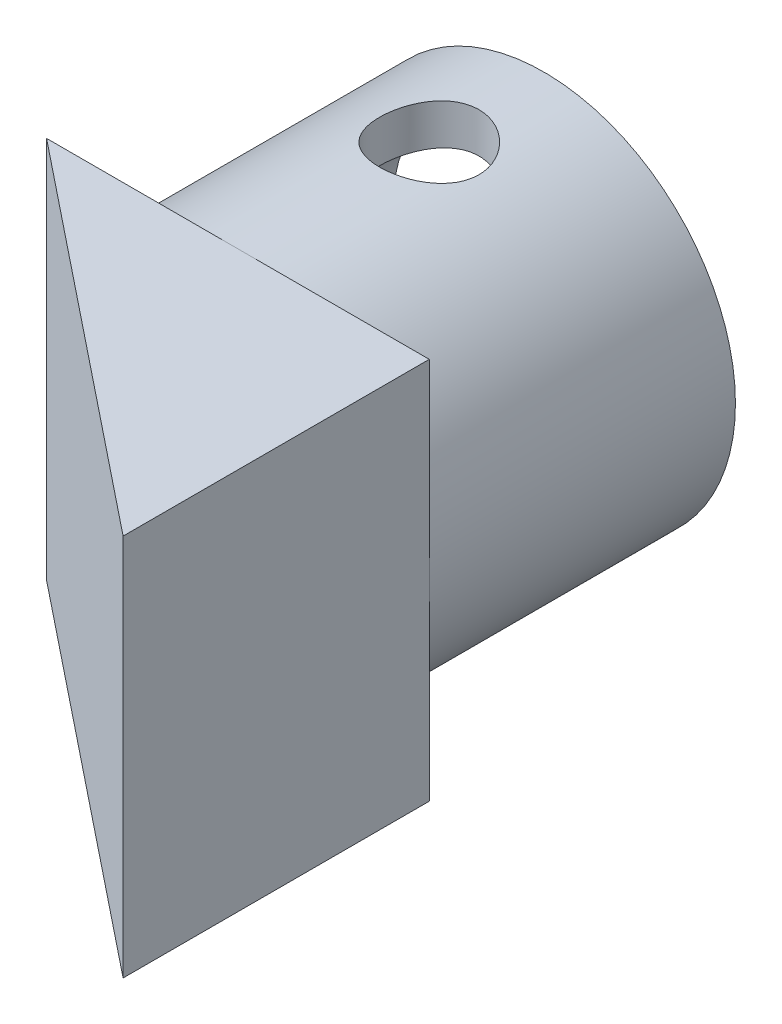
from build123d import *

# Parameters (mm, degrees)
SKETCH1_R                = 5
SKETCH1_R_2              = 3.95
BOSS_EXTRUDE1_DEPTH      = 8
BOSS_EXTRUDE2_DEPTH      = 5
BOSS_EXTRUDE2_DEPTH_BACK = 5
CUT_EXTRUDE1_DEPTH       = 18.492855685
CUT_EXTRUDE1_DEPTH_BACK  = 18.492855685
SKETCH4_R                = 1.3


with BuildPart() as part:
    # Sketch1 → Boss-Extrude1 (new body)
    with BuildSketch(Plane.XY):
        Circle(SKETCH1_R)
        Circle(SKETCH1_R_2, mode=Mode.SUBTRACT)
    extrude(amount=BOSS_EXTRUDE1_DEPTH)

    # Sketch3 → Boss-Extrude2 (add, two sides: drawn at the far end of the back side and taken through both)
    with BuildSketch(Plane(origin=(0, 0, 0), x_dir=(1, 0, 0), z_dir=(0, 1, 0)).offset(-BOSS_EXTRUDE2_DEPTH_BACK)):
        Polygon((5, -16), (-5, -8), (5, -8), align=None)
    extrude(amount=BOSS_EXTRUDE2_DEPTH + BOSS_EXTRUDE2_DEPTH_BACK)

    # Sketch4 → Cut-Extrude1 (cut, two sides: drawn at the far end of the back side and taken through both)
    with BuildSketch(Plane(origin=(0, 0, 0), x_dir=(1, 0, 0), z_dir=(0, 1, 0)).offset(-CUT_EXTRUDE1_DEPTH_BACK)):
        with Locations((0, -3)):
            Circle(SKETCH4_R)
    extrude(amount=CUT_EXTRUDE1_DEPTH + CUT_EXTRUDE1_DEPTH_BACK, mode=Mode.SUBTRACT)


solid = part.part
